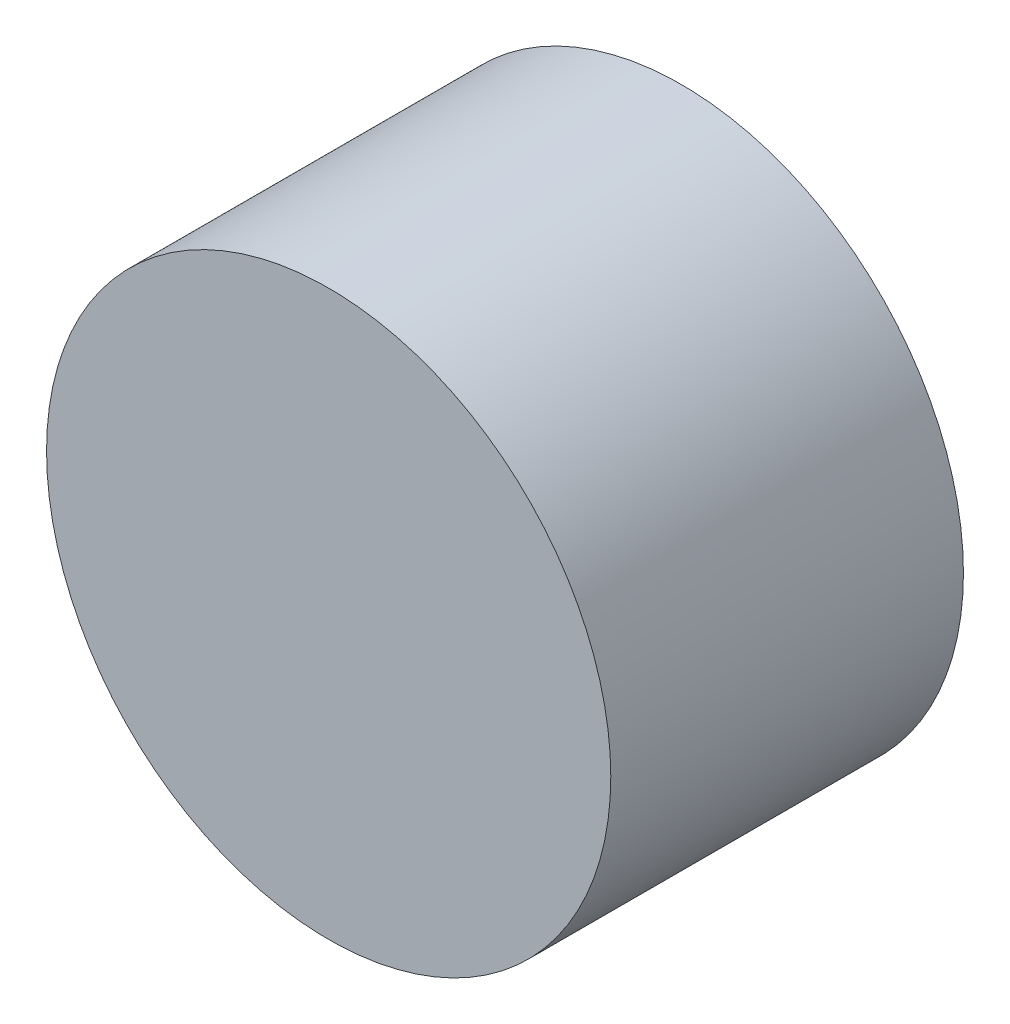
from build123d import *

# Parameters (mm, degrees)
SKETCH1_R           = 4
BOSS_EXTRUDE1_DEPTH = 5


with BuildPart() as part:
    # Sketch1 → Boss-Extrude1 (new body)
    with BuildSketch(Plane.XY):
        Circle(SKETCH1_R)
    extrude(amount=BOSS_EXTRUDE1_DEPTH)


solid = part.part
